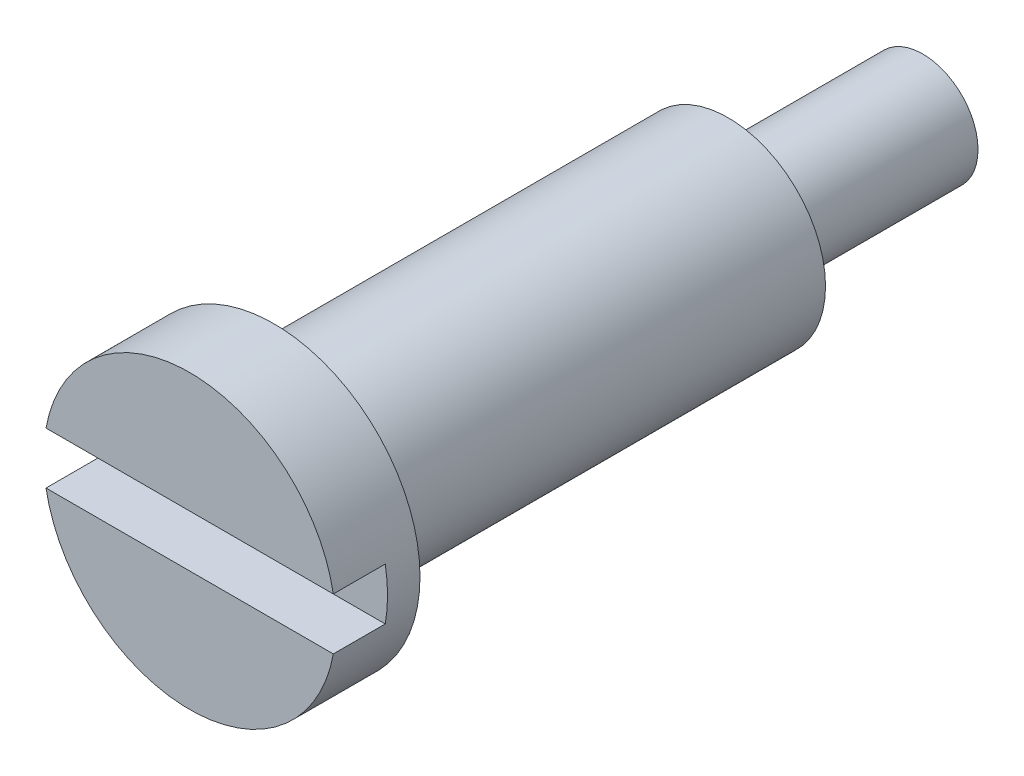
from build123d import *

# Parameters (mm, degrees)
SKETCH2_R           = 2.25
BOSS_EXTRUDE1_DEPTH = 1.3
SKETCH3_W           = 4.890037446
SKETCH3_H           = 0.8
CUT_EXTRUDE1_DEPTH  = 0.8
SKETCH4_R           = 1.5
BOSS_EXTRUDE2_DEPTH = 7
SKETCH5_R           = 0.85
BOSS_EXTRUDE3_DEPTH = 3


with BuildPart() as part:
    # Sketch2 → Boss-Extrude1 (new body)
    with BuildSketch(Plane.XY):
        Circle(SKETCH2_R)
    extrude(amount=BOSS_EXTRUDE1_DEPTH)

    # Sketch3 → Cut-Extrude1 (cut)
    with BuildSketch(Plane.XY.offset(1.3)):
        Rectangle(SKETCH3_W, SKETCH3_H)
    extrude(amount=-CUT_EXTRUDE1_DEPTH, mode=Mode.SUBTRACT)

    # Sketch4 → Boss-Extrude2 (add)
    with BuildSketch(Plane(origin=(0, 0, 0), x_dir=(-1, 0, 0), z_dir=(0, 0, -1))):
        Circle(SKETCH4_R)
    extrude(amount=BOSS_EXTRUDE2_DEPTH)

    # Sketch5 → Boss-Extrude3 (add)
    with BuildSketch(Plane(origin=(0, 0, -7), x_dir=(-1, 0, 0), z_dir=(0, 0, -1))):
        with Locations(Location((0, 0, 0), (0, 0, 180))):
            Circle(SKETCH5_R)
    extrude(amount=BOSS_EXTRUDE3_DEPTH)


solid = part.part
